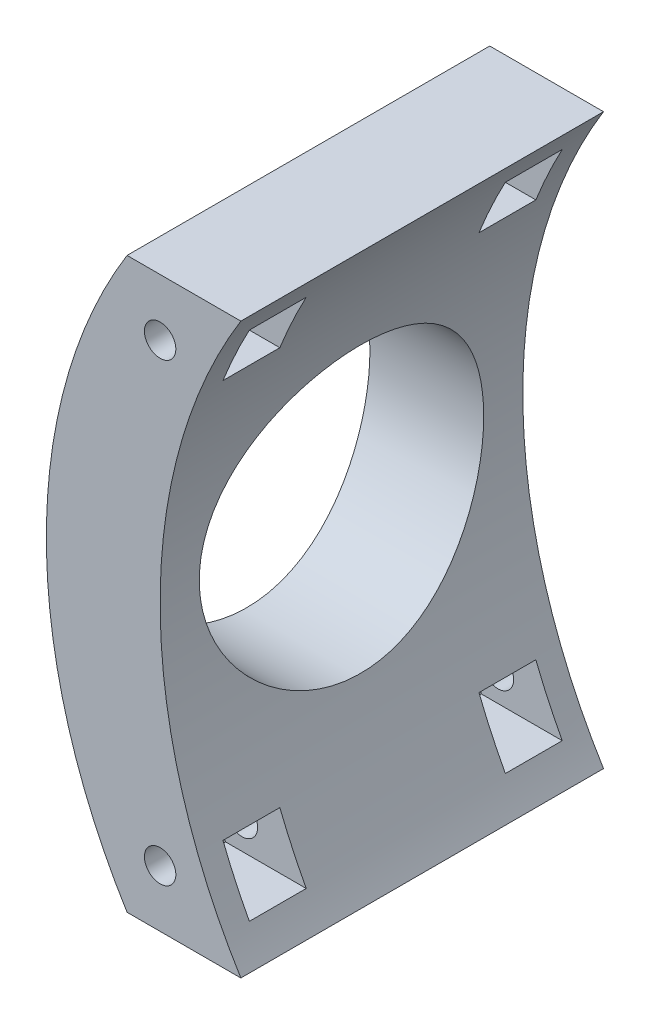
from build123d import *

# Parameters (mm, degrees)
SKETCH1_R               = 1.7526
BOSS_EXTRUDE1_DEPTH     = 20.240625
CUT_EXTRUDE1_START      = 17.4625
CUT_EXTRUDE1_DEPTH      = 6.35
CUT_EXTRUDE2_START      = -17.4625
CUT_EXTRUDE2_DEPTH      = 6.35
CUT_EXTRUDE3_DEPTH      = 40.737078408
CUT_EXTRUDE3_DEPTH_BACK = 40.737078408
SKETCH4_R               = 15.875


with BuildPart() as part:
    # Sketch1 → Boss-Extrude1 (new, symmetric)
    with BuildSketch(Plane.XY):
        with BuildLine():
            Line((0, 31.75), (12.7, 31.75))
            ThreePointArc((12.7, 31.75), (3.690995675, 0), (12.7, -31.75))
            Line((12.7, -31.75), (0, -31.75))
            ThreePointArc((0, -31.75), (-9.009004325, 0), (0, 31.75))
        make_face()
        with Locations((3.690995675, 25.4)):
            Circle(SKETCH1_R, mode=Mode.SUBTRACT)
        with Locations((3.690995675, -25.4)):
            Circle(SKETCH1_R, mode=Mode.SUBTRACT)
    extrude(amount=BOSS_EXTRUDE1_DEPTH, both=True)

    # Sketch2 → Cut-Extrude1 (cut)
    with BuildSketch(Plane.XY.offset(CUT_EXTRUDE1_START)):
        Polygon((21.851555668, 28.575), (1.85790857, 28.575), (0.024821465, 25.4), (1.85790857, 22.225), (21.851555668, 22.225), align=None)
        Polygon((21.851555668, -28.575), (21.851555668, -22.225), (1.85790857, -22.225), (0.024821465, -25.4), (1.85790857, -28.575), align=None)
    extrude(amount=-CUT_EXTRUDE1_DEPTH, mode=Mode.SUBTRACT)

    # Sketch2<2> → Cut-Extrude2 (cut)
    with BuildSketch(Plane.XY.offset(CUT_EXTRUDE2_START)):
        Polygon((21.851555668, 28.575), (1.85790857, 28.575), (0.024821465, 25.4), (1.85790857, 22.225), (21.851555668, 22.225), align=None)
        Polygon((21.851555668, -28.575), (21.851555668, -22.225), (1.85790857, -22.225), (0.024821465, -25.4), (1.85790857, -28.575), align=None)
    extrude(amount=CUT_EXTRUDE2_DEPTH, mode=Mode.SUBTRACT)

    # Sketch4 → Cut-Extrude3 (cut, two sides: drawn at the far end of the back side and taken through both)
    with BuildSketch(Plane(origin=(0, 0, 0), x_dir=(0, 0, -1), z_dir=(1, 0, 0)).offset(-CUT_EXTRUDE3_DEPTH_BACK)):
        Circle(SKETCH4_R)
    extrude(amount=CUT_EXTRUDE3_DEPTH + CUT_EXTRUDE3_DEPTH_BACK, mode=Mode.SUBTRACT)


solid = part.part
